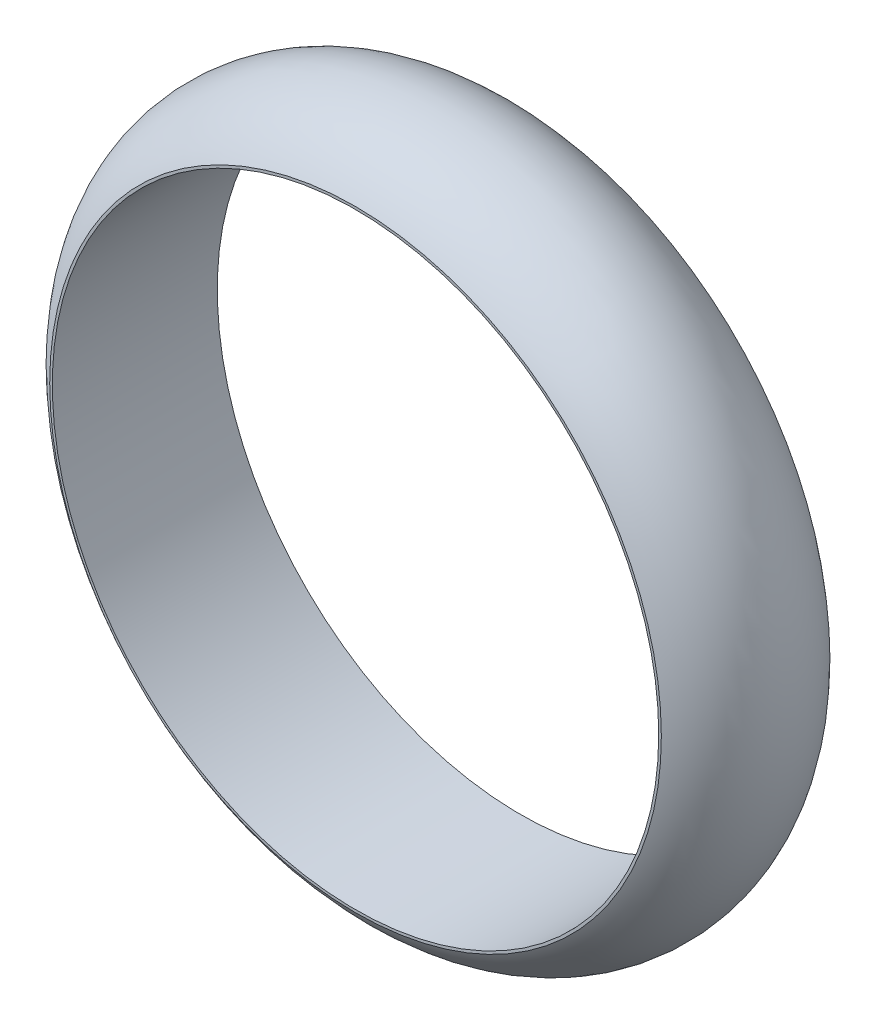
from build123d import *

# Parameters (mm, degrees)
SKETCH_1_R      = 72.5
SKETCH_1_R_2    = 62.5
EXTRUDE_1_DEPTH = 34


with BuildPart() as part:
    # 草图1 → 凸台-拉伸1 (new body)
    with BuildSketch(Plane.XY):
        Circle(SKETCH_1_R)
        Circle(SKETCH_1_R_2, mode=Mode.SUBTRACT)
    extrude(amount=EXTRUDE_1_DEPTH)

    # 草图3 → 切除-旋转1 (revolve, cut)
    with BuildSketch(Plane(origin=(0, 0, 0), x_dir=(0, 0, -1), z_dir=(1, 0, 0))):
        with BuildLine():
            Line((-34, 72.5), (-34, 63.035653753))
            ThreePointArc((-34, 63.035653753), (-26.728487163, 69.974453855), (-17, 72.5))
            Line((-17, 72.5), (-34, 72.5))
        make_face()
        with BuildLine():
            Line((0, 72.5), (-17, 72.5))
            ThreePointArc((-17, 72.5), (-7.271512837, 69.974453855), (0, 63.035653753))
            Line((0, 63.035653753), (0, 72.5))
        make_face()
    revolve(axis=Axis((0, 0, 0), (0, 0, 1)), mode=Mode.SUBTRACT)


solid = part.part
